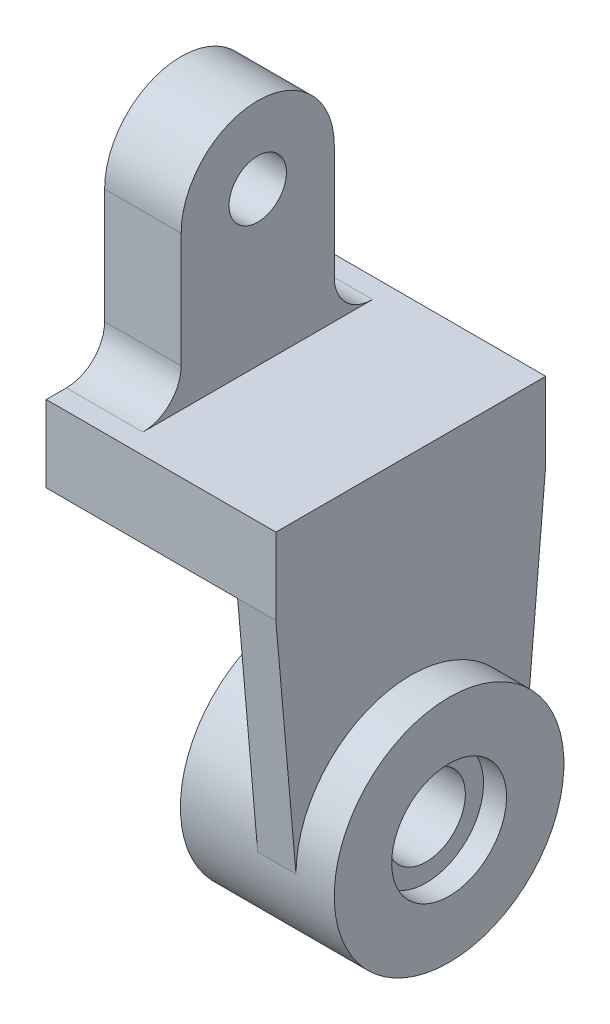
from build123d import *

# Parameters (mm, degrees)
BOSS_EXTRUDE1_DEPTH      = 70.5
BOSS_EXTRUDE2_DEPTH      = 10
BOSS_EXTRUDE2_DEPTH_BACK = 30.2
SKETCH2_R                = 30
SKETCH3_R                = 10.25
CUT_EXTRUDE1_DEPTH       = 92
SKETCH4_R                = 15
CUT_EXTRUDE2_DEPTH       = 6
CUT_EXTRUDE_THIN1_DEPTH  = 53
SKETCH7_R                = 7.5
BOSS_EXTRUDE5_DEPTH      = 20


with BuildPart() as part:
    # Sketch1 → Boss-Extrude1 (new body)
    with BuildSketch(Plane.XY):
        Polygon((-30, 10), (30, 10), (30, -70), (20, -70), (20, -10), (-30, -10), align=None)
    extrude(amount=-BOSS_EXTRUDE1_DEPTH)

    # Sketch2 → Boss-Extrude2 (add, two sides: drawn at the far end of the back side and taken through both)
    with BuildSketch(Plane(origin=(30, 0, 0), x_dir=(0, 0, -1), z_dir=(1, 0, 0)).offset(-BOSS_EXTRUDE2_DEPTH_BACK)):
        with Locations(Location((35.25, -70, 0), (0, 0, 90))):
            Circle(SKETCH2_R)
    extrude(amount=BOSS_EXTRUDE2_DEPTH + BOSS_EXTRUDE2_DEPTH_BACK)

    # Sketch3 → Cut-Extrude1 (cut)
    with BuildSketch(Plane(origin=(40, 0, 0), x_dir=(0, 0, -1), z_dir=(1, 0, 0))):
        with Locations(Location((35.25, -70, 0), (0, 0, 90))):
            Circle(SKETCH3_R)
    extrude(amount=-CUT_EXTRUDE1_DEPTH, mode=Mode.SUBTRACT)

    # Sketch4 → Cut-Extrude2 (cut)
    with BuildSketch(Plane(origin=(40, 0, 0), x_dir=(0, 0, -1), z_dir=(1, 0, 0))):
        with Locations(Location((35.25, -70, 0), (0, 0, 90))):
            Circle(SKETCH4_R)
    extrude(amount=-CUT_EXTRUDE2_DEPTH, mode=Mode.SUBTRACT)

    # Sketch5 → Cut-Extrude-Thin1 (cut)
    with BuildSketch(Plane(origin=(30, 0, 0), x_dir=(0, 0, -1), z_dir=(1, 0, 0))):
        Polygon((0, -10), (5.25, -70), (-4.711937175, -70.871669503), (-9.961937175, -10.871669503), align=None)
        Polygon((65.25, -70), (70.5, -10), (80.461937175, -10.871669503), (75.211937175, -70.871669503), align=None)
    extrude(amount=-CUT_EXTRUDE_THIN1_DEPTH, mode=Mode.SUBTRACT)

    # Sketch7 → Boss-Extrude5 (add)
    with BuildSketch(Plane.ZY.offset(30)):
        with BuildLine():
            ThreePointArc((-15.25, 50), (-35.25, 70), (-55.25, 50))
            Line((-55.25, 50), (-55.25, 20))
            ThreePointArc((-55.25, 20), (-58.178932188, 12.928932188), (-65.25, 10))
            Line((-65.25, 10), (-5.25, 10))
            ThreePointArc((-5.25, 10), (-12.321067812, 12.928932188), (-15.25, 20))
            Line((-15.25, 20), (-15.25, 50))
        make_face()
        with Locations(Location((-35.25, 50, 0), (0, 0, 270))):
            Circle(SKETCH7_R, mode=Mode.SUBTRACT)
    extrude(amount=-BOSS_EXTRUDE5_DEPTH)


solid = part.part
